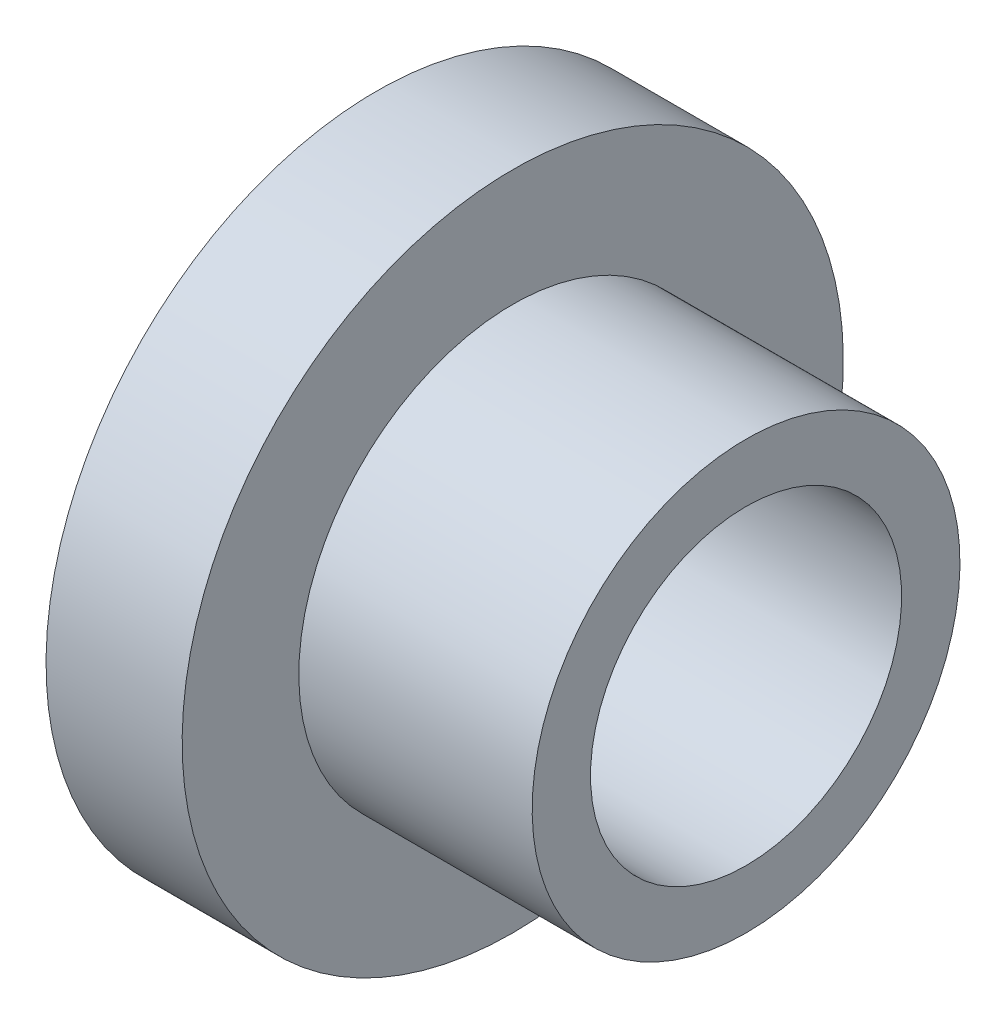
from build123d import *


with BuildPart() as part:
    # Esquisse1 → Révolution1 (revolve)
    with BuildSketch(Plane.XY):
        Polygon((9.5, -8), (9.5, -11), (-2.5, -11), (-2.5, -17), (-9.5, -17), (-9.5, -8), align=None)
    revolve(axis=Axis((-12.5, 0, 0), (1, 0, 0)))


solid = part.part
